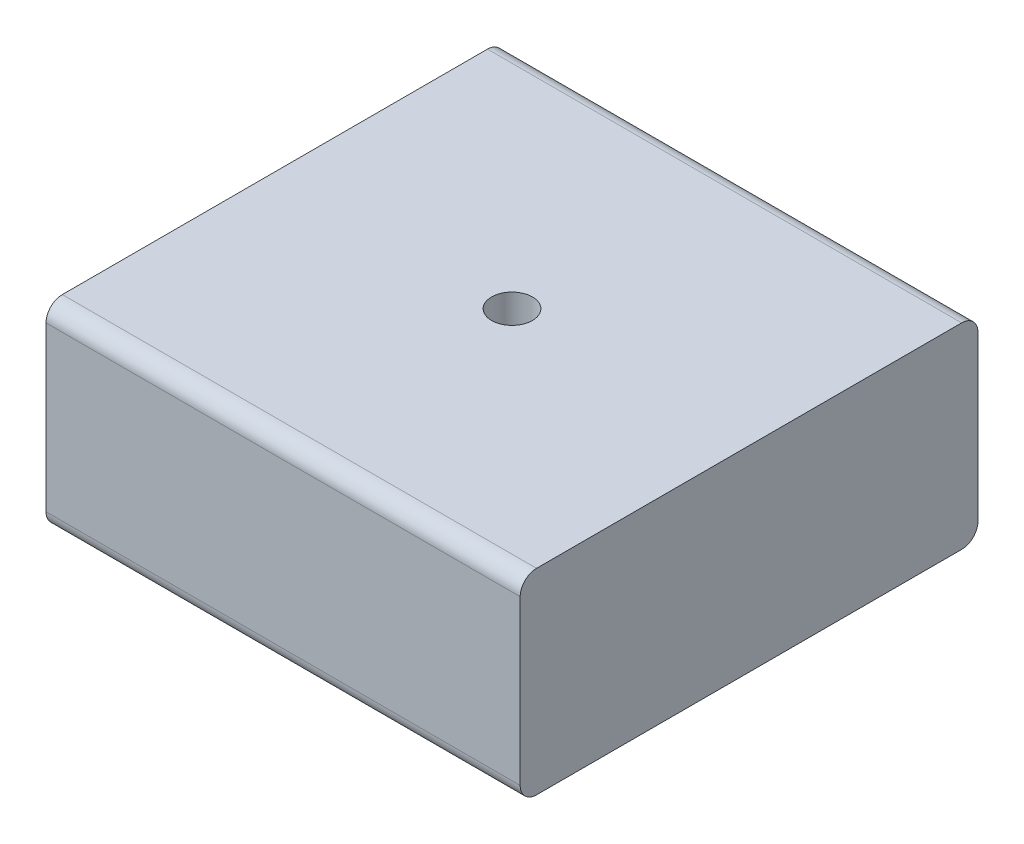
from build123d import *

# Parameters (mm, degrees)
SKETCH1_W                      = 92.075
SKETCH1_H                      = 38.1
BOSS_EXTRUDE1_DEPTH            = 88.9
FILLET1_R                      = 3.175
F_5_16_0_3125_DIAMETER_HOLE1_D = 7.9375


with BuildPart() as part:
    # Sketch1 → Boss-Extrude1 (new body)
    with BuildSketch(Plane.XY):
        with Locations((0, 19.05)):
            Rectangle(SKETCH1_W, SKETCH1_H)
    extrude(amount=BOSS_EXTRUDE1_DEPTH)

    # Fillet1
    fillet1_edges = [part.edges().sort_by_distance(p)[0] for p in [
        (0, 38.1, 88.9),
        (0, 38.1, 0),
        (0, 0, 0),
        (0, 0, 88.9),
    ]]
    fillet(fillet1_edges, radius=FILLET1_R)

    # 5/16 (0.3125) Diameter Hole1 (through all)
    with Locations(Plane(origin=(0, 38.1, 0), x_dir=(1, 0, 0), z_dir=(0, 1, 0))):
        with Locations((0, -44.45)):
            Hole(F_5_16_0_3125_DIAMETER_HOLE1_D / 2)


solid = part.part
